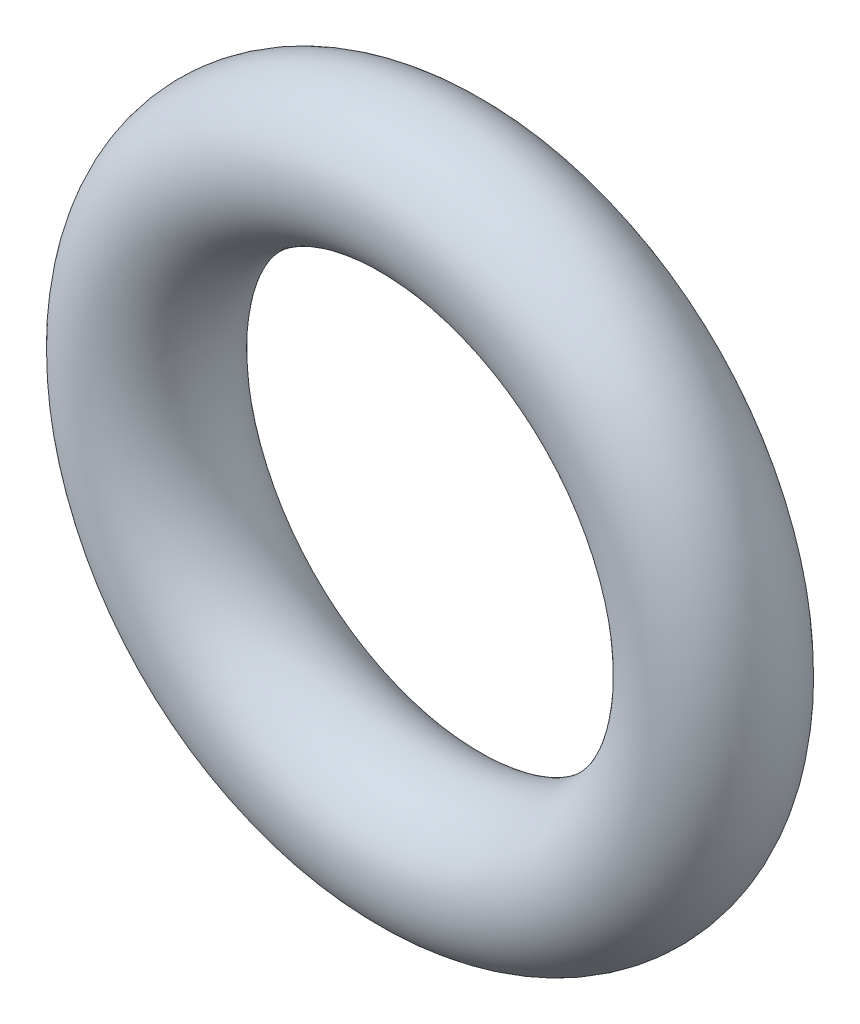
from build123d import *

# Parameters (mm, degrees)
SKETCH_MAIN_PROFILE_R = 5


with BuildPart() as part:
    # sketch:main-profile → feature:torus (revolve)
    with BuildSketch(Plane.XZ, mode=Mode.PRIVATE) as feature_torus_sk:
        with Locations((20, 0)):
            Circle(SKETCH_MAIN_PROFILE_R)
    revolve(feature_torus_sk.sketch.rotate(Axis((0, 0, -15), (0, 0, 1)), 180), axis=Axis((0, 0, -15), (0, 0, 1)))


solid = part.part
